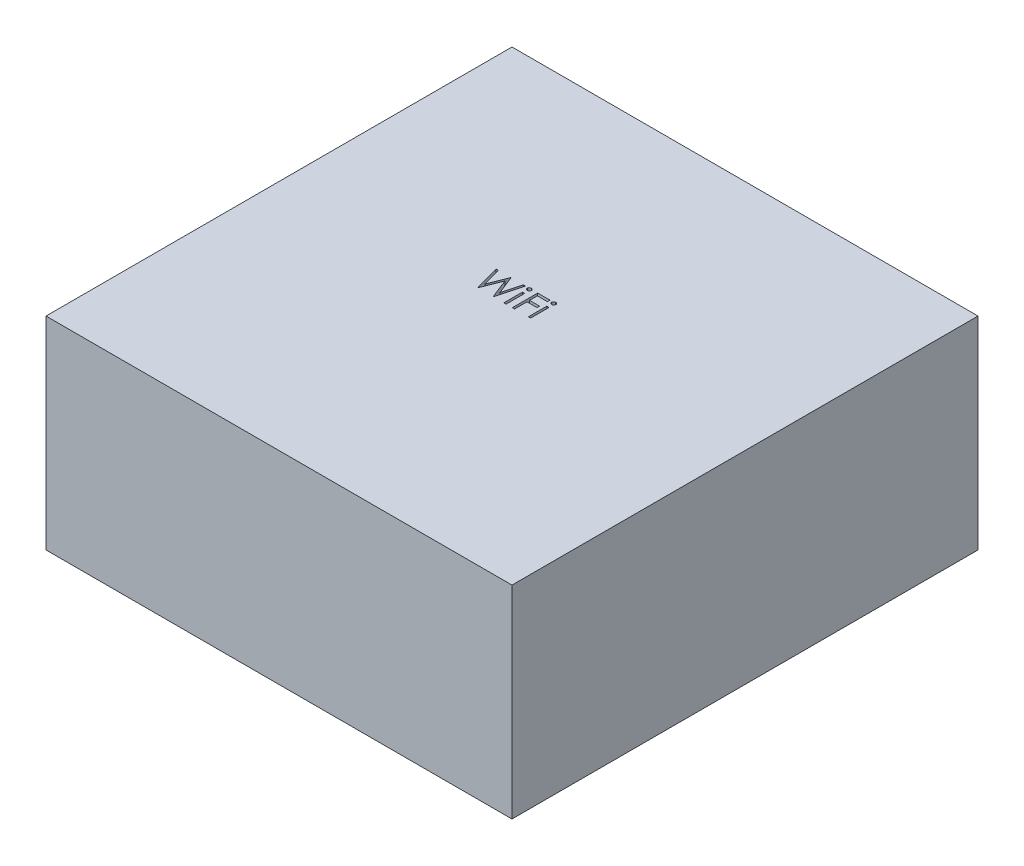
from build123d import *

# Parameters (mm, degrees)
SKETCH1_W           = 58.42
SKETCH1_H           = 58.42
BOSS_EXTRUDE1_DEPTH = 25.4
SKETCH2_W           = 0.284935898
SKETCH2_H           = 2.320192308
SKETCH2_W_2         = 0.284935897
CUT_EXTRUDE1_DEPTH  = 7.62


with BuildPart() as part:
    # Sketch1 → Boss-Extrude1 (new body)
    with BuildSketch(Plane(origin=(0, 0, 0), x_dir=(1, 0, 0), z_dir=(0, 1, 0))):
        with Locations((29.21, 29.21)):
            Rectangle(SKETCH1_W, SKETCH1_H)
    extrude(amount=BOSS_EXTRUDE1_DEPTH)

    # Sketch2 → Cut-Extrude1 (cut)
    with BuildSketch(Plane(origin=(0, 25.4, 0), x_dir=(1, 0, 0), z_dir=(0, 1, 0))):
        Polygon((23.114155591, 33.314953012), (23.408631753, 33.314953012), (24.030020976, 30.986492475), (24.95415459, 33.314953012), (24.995495735, 33.314953012), (25.902456873, 31.002392916), (26.527026184, 33.314953012), (26.818322258, 33.314953012), (25.96224253, 30.139953012), (25.921537402, 30.139953012), (24.966238925, 32.568268317), (23.99949213, 30.139953012), (23.958787001, 30.139953012), align=None)
        with BuildLine():
            add(Edge.make_bspline(
                [(27.407274582, 33.437068397), (27.42495599, 33.436248201), (27.459579582, 33.434642101), (27.509647761, 33.420888476), (27.55523805, 33.39757519), (27.595676422, 33.366297193), (27.630376348, 33.329513055), (27.654670278, 33.286640605), (27.67028438, 33.240323126), (27.672169927, 33.208015152), (27.67312995, 33.191565592)],
                knots=[0, 0, 0, 0, 1.055194115, 2.066272739, 3.074728998, 4.095836921, 5.109056067, 6.073838105, 7.019297344, 8, 8, 8, 8], degree=3))
            add(Edge.make_bspline(
                [(27.67312995, 33.191565592), (27.672148277, 33.175543043), (27.670207624, 33.143868358), (27.654682338, 33.098353851), (27.630169308, 33.056077108), (27.595698673, 33.019364393), (27.555232154, 32.988103687), (27.509649327, 32.964785817), (27.45957917, 32.951033407), (27.42495585, 32.949427139), (27.407274582, 32.948606858)],
                knots=[0, 0, 0, 0, 0.96129708, 1.900370562, 2.859976407, 3.87933698, 4.906634145, 5.921202961, 6.938410037, 8, 8, 8, 8], degree=3))
            add(Edge.make_bspline(
                [(27.407274582, 32.948606858), (27.389795503, 32.949395819), (27.355774761, 32.950931427), (27.306456269, 32.965055658), (27.26125471, 32.988111667), (27.220737472, 33.019159706), (27.186964368, 33.056302577), (27.162382316, 33.098328051), (27.146892886, 33.143874927), (27.144947401, 33.175545249), (27.143963284, 33.191565592)],
                knots=[0, 0, 0, 0, 1.054934014, 2.053291228, 3.073705704, 4.106921865, 5.123545215, 6.088680038, 7.033164197, 8, 8, 8, 8], degree=3))
            add(Edge.make_bspline(
                [(27.143963284, 33.191565592), (27.144925841, 33.208012863), (27.146816364, 33.24031634), (27.162393926, 33.286666835), (27.186759609, 33.329285768), (27.220759834, 33.366501757), (27.261248759, 33.397567259), (27.306457806, 33.420618649), (27.355774355, 33.434744078), (27.389795366, 33.436279521), (27.407274582, 33.437068397)],
                knots=[0, 0, 0, 0, 0.98631895, 1.937192651, 2.907499808, 3.917963147, 4.944918757, 5.95915025, 6.951458133, 8, 8, 8, 8], degree=3))
        make_face()
        with Locations((27.408546617, 31.300049166)):
            Rectangle(SKETCH2_W, SKETCH2_H)
        Polygon((28.324412001, 33.314953012), (29.871206873, 33.314953012), (29.871206873, 32.989311986), (28.609347899, 32.989311986), (28.609347899, 32.01238891), (29.871206873, 32.01238891), (29.871206873, 31.686747884), (28.609347899, 31.686747884), (28.609347899, 30.139953012), (28.324412001, 30.139953012), align=None)
        with BuildLine():
            add(Edge.make_bspline(
                [(30.460159197, 33.437068397), (30.477840605, 33.436248201), (30.512464197, 33.434642101), (30.562532376, 33.420888476), (30.608122666, 33.39757519), (30.648561038, 33.366297193), (30.683260963, 33.329513055), (30.707554893, 33.286640605), (30.723168996, 33.240323126), (30.725054542, 33.208015152), (30.726014566, 33.191565592)],
                knots=[0, 0, 0, 0, 1.055194115, 2.066272739, 3.074728998, 4.095836921, 5.109056067, 6.073838105, 7.019297344, 8, 8, 8, 8], degree=3))
            add(Edge.make_bspline(
                [(30.726014566, 33.191565592), (30.725032892, 33.175543043), (30.72309224, 33.143868358), (30.707566954, 33.098353851), (30.683053924, 33.056077108), (30.648583288, 33.019364393), (30.608116769, 32.988103687), (30.562533942, 32.964785817), (30.512463785, 32.951033407), (30.477840466, 32.949427139), (30.460159197, 32.948606858)],
                knots=[0, 0, 0, 0, 0.96129708, 1.900370562, 2.859976407, 3.87933698, 4.906634145, 5.921202961, 6.938410037, 8, 8, 8, 8], degree=3))
            add(Edge.make_bspline(
                [(30.460159197, 32.948606858), (30.442680119, 32.949395819), (30.408659377, 32.950931427), (30.359340884, 32.965055658), (30.314139326, 32.988111667), (30.273622087, 33.019159706), (30.239848983, 33.056302577), (30.215266931, 33.098328051), (30.199777501, 33.143874927), (30.197832017, 33.175545249), (30.196847899, 33.191565592)],
                knots=[0, 0, 0, 0, 1.054934014, 2.053291228, 3.073705704, 4.106921865, 5.123545215, 6.088680038, 7.033164197, 8, 8, 8, 8], degree=3))
            add(Edge.make_bspline(
                [(30.196847899, 33.191565592), (30.197810456, 33.208012863), (30.199700979, 33.24031634), (30.215278542, 33.286666835), (30.239644224, 33.329285768), (30.27364445, 33.366501757), (30.314133374, 33.397567259), (30.359342422, 33.420618649), (30.408658971, 33.434744078), (30.442679981, 33.436279521), (30.460159197, 33.437068397)],
                knots=[0, 0, 0, 0, 0.98631895, 1.937192651, 2.907499808, 3.917963147, 4.944918757, 5.95915025, 6.951458133, 8, 8, 8, 8], degree=3))
        make_face()
        with Locations((30.461431233, 31.300049166)):
            Rectangle(SKETCH2_W_2, SKETCH2_H)
    extrude(amount=-CUT_EXTRUDE1_DEPTH, mode=Mode.SUBTRACT)


solid = part.part
